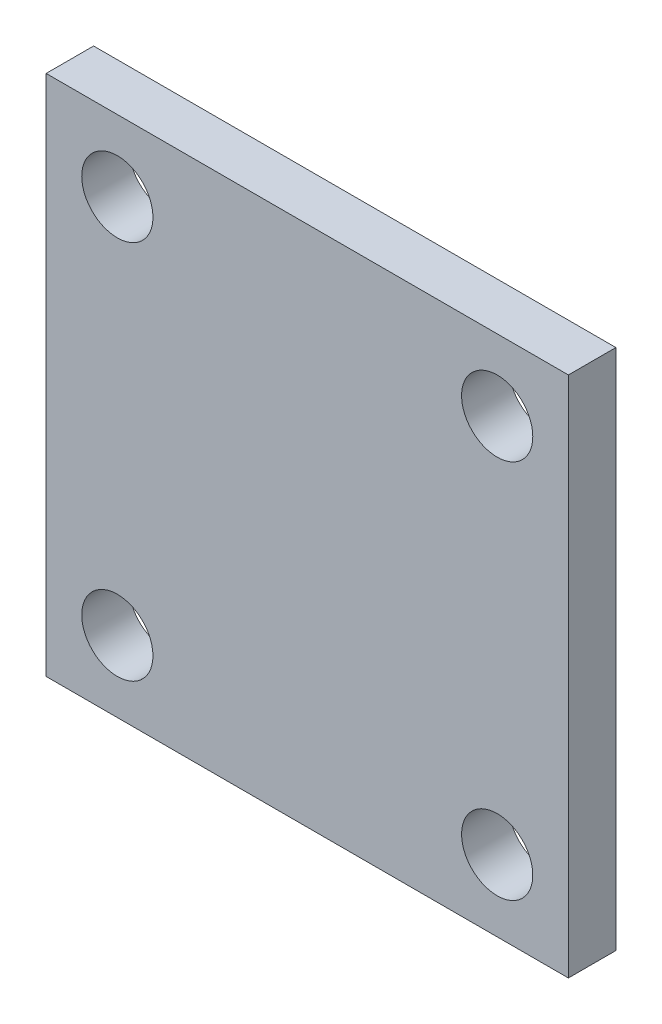
from build123d import *

# Parameters (mm, degrees)
SKETCH1_W           = 22
SKETCH1_H           = 22
SKETCH1_R           = 1.5
BOSS_EXTRUDE1_DEPTH = 2


with BuildPart() as part:
    # Sketch1 → Boss-Extrude1 (new body)
    with BuildSketch(Plane.XY):
        Rectangle(SKETCH1_W, SKETCH1_H)
        with Locations((8, 8)):
            Circle(SKETCH1_R, mode=Mode.SUBTRACT)
        with Locations(Location((8, -8, 0), (0, 0, 180))):
            Circle(SKETCH1_R, mode=Mode.SUBTRACT)
        with Locations((-8, -8)):
            Circle(SKETCH1_R, mode=Mode.SUBTRACT)
        with Locations(Location((-8, 8, 0), (0, 0, 180))):
            Circle(SKETCH1_R, mode=Mode.SUBTRACT)
    extrude(amount=BOSS_EXTRUDE1_DEPTH)


solid = part.part
